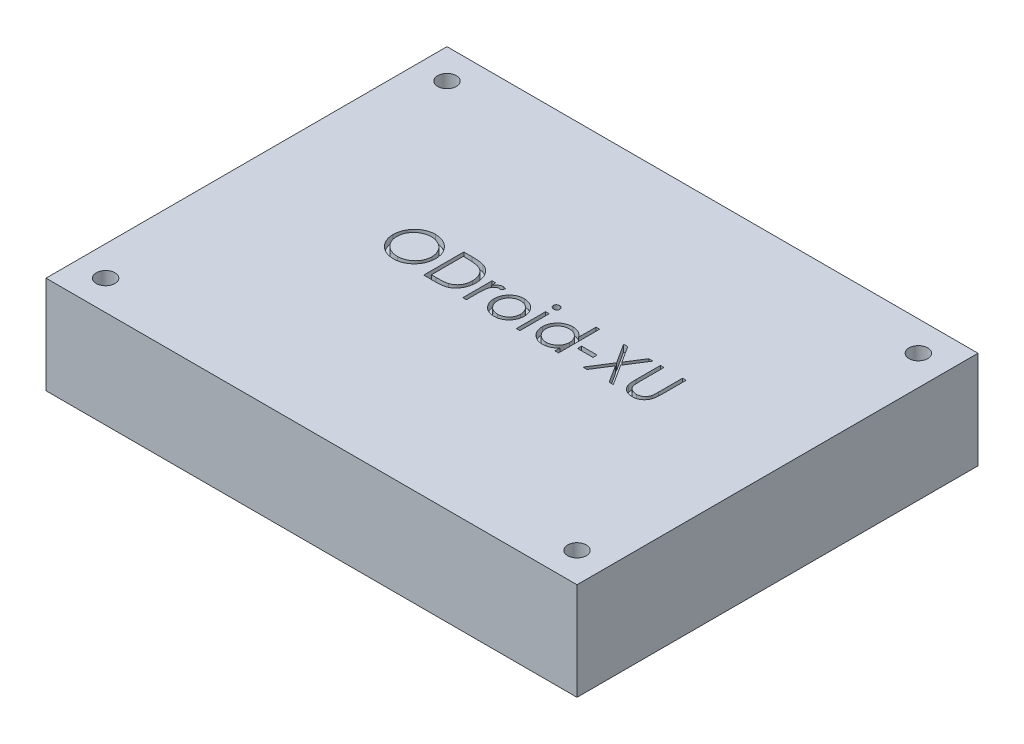
from build123d import *

# Parameters (mm, degrees)
SKETCH1_W                   = 98
SKETCH1_H                   = 74
BOSS_EXTRUDE1_DEPTH         = 18
SKETCH2_W                   = 0.664850427
SKETCH2_H                   = 5.413782051
SKETCH2_W_2                 = 2.849358974
SKETCH2_H_2                 = 0.759829059
CUT_EXTRUDE1_DEPTH          = 1.27
F_29_0_136_DIAMETER_HOLE1_D = 3.4544


with BuildPart() as part:
    # Sketch1 → Boss-Extrude1 (new body)
    with BuildSketch(Plane(origin=(0, 0, 0), x_dir=(1, 0, 0), z_dir=(0, 1, 0))):
        Rectangle(SKETCH1_W, SKETCH1_H)
    extrude(amount=BOSS_EXTRUDE1_DEPTH)

    # Sketch2 → Cut-Extrude1 (cut)
    # profile 1 of 10: a face of its own
    with BuildSketch(Plane(origin=(0, 18, 0), x_dir=(1, 0, 0), z_dir=(0, 1, 0))):
        with BuildLine():
            add(Edge.make_bspline(
                [(-20.098489134, 5.934773043), (-19.961311977, 5.931298579), (-19.691884721, 5.924474444), (-19.295909521, 5.872237008), (-18.917883236, 5.781865099), (-18.554726442, 5.661505119), (-18.210782975, 5.50094667), (-17.883463986, 5.306879773), (-17.57354827, 5.077271269), (-17.285213012, 4.813896072), (-17.021355801, 4.527334428), (-16.788891008, 4.221522851), (-16.594068153, 3.898310386), (-16.434078237, 3.558668295), (-16.308562847, 3.203364696), (-16.221950871, 2.83050539), (-16.16662512, 2.44250623), (-16.160157058, 2.177866033), (-16.156875886, 2.043617194)],
                knots=[0, 0, 0, 0, 1.065120563, 2.091984664, 3.0946048, 4.079830382, 5.057816894, 6.036188127, 7.030412546, 8.04752943, 9.064399622, 10.05169764, 11.02544977, 11.989514704, 12.962713494, 13.945757189, 14.957906945, 16, 16, 16, 16], degree=3))
            add(Edge.make_bspline(
                [(-16.156875886, 2.043617194), (-16.160156577, 1.910357266), (-16.166623198, 1.647686509), (-16.222013777, 1.262149553), (-16.308883893, 0.891540912), (-16.432912657, 0.53647928), (-16.59213992, 0.196590103), (-16.788260032, -0.127232282), (-17.019275595, -0.435094037), (-17.282180096, -0.723622512), (-17.568778968, -0.988200492), (-17.876183033, -1.218745445), (-18.197478893, -1.417128176), (-18.536801109, -1.575420285), (-18.88964952, -1.701937517), (-19.259182104, -1.788197251), (-19.64366731, -1.843838159), (-19.905860935, -1.850227351), (-20.039127489, -1.85347482)],
                knots=[0, 0, 0, 0, 1.043624062, 2.057103931, 3.04512605, 4.022047818, 4.998200453, 5.980619268, 6.982898556, 8.009068085, 9.034988726, 10.034168286, 11.015286542, 11.987931943, 12.962482838, 13.94673481, 14.956375938, 16, 16, 16, 16], degree=3))
            add(Edge.make_bspline(
                [(-20.039127489, -1.85347482), (-20.173375631, -1.850195284), (-20.438014454, -1.843730447), (-20.826501179, -1.78831314), (-21.199622404, -1.701654047), (-21.556311114, -1.577809074), (-21.896766215, -1.417752602), (-22.221653556, -1.222586666), (-22.529669085, -0.991008217), (-22.818259115, -0.728188968), (-23.082311584, -0.442075849), (-23.31251893, -0.135510009), (-23.507728753, 0.18549404), (-23.667247807, 0.521827133), (-23.793537579, 0.871863354), (-23.879696111, 1.237937631), (-23.935440542, 1.617962918), (-23.941864301, 1.876710386), (-23.945123749, 2.008000207)],
                knots=[0, 0, 0, 0, 1.053102029, 2.075944431, 3.073151272, 4.055350789, 5.033113405, 6.020478099, 7.024410459, 8.052272461, 9.079885166, 10.07527673, 11.055994387, 12.023226415, 12.992069828, 13.970394897, 14.97016774, 16, 16, 16, 16], degree=3))
            add(Edge.make_bspline(
                [(-23.945123749, 2.008000207), (-23.943992104, 2.09612269), (-23.94174309, 2.271255951), (-23.914667341, 2.531323588), (-23.875378407, 2.787208814), (-23.819071025, 3.038183987), (-23.745428664, 3.283634738), (-23.658535206, 3.525253853), (-23.552405866, 3.760592735), (-23.432431828, 3.990766247), (-23.298527668, 4.212186315), (-23.150623998, 4.421481432), (-22.993915801, 4.620407875), (-22.822119951, 4.8038107), (-22.640898476, 4.977025273), (-22.447311575, 5.137389691), (-22.242540492, 5.286350003), (-22.025704121, 5.420589725), (-21.802145439, 5.541999894), (-21.571689593, 5.646186145), (-21.337466517, 5.735606975), (-21.098379178, 5.808083388), (-20.855062478, 5.865301198), (-20.606985367, 5.90426343), (-20.354345481, 5.931408236), (-20.184141523, 5.933646615), (-20.098489134, 5.934773043)],
                knots=[0, 0, 0, 0, 1.037015668, 2.060948919, 3.074880161, 4.083647147, 5.086022904, 6.090072063, 7.104153813, 8.122640571, 9.144368836, 10.147691507, 11.138137339, 12.123020368, 13.103399296, 14.087645067, 15.080126199, 16.082011238, 17.087798457, 18.072939717, 19.057185487, 20.037253025, 21.01195951, 21.997135196, 22.992090687, 24, 24, 24, 24], degree=3))
        make_face()
        with BuildLine():
            add(Edge.make_bspline(
                [(-20.065840229, 5.174943984), (-20.136144537, 5.174086966), (-20.276081038, 5.172381124), (-20.48411664, 5.149911192), (-20.689416233, 5.117886261), (-20.892022216, 5.072205375), (-21.091086862, 5.009966797), (-21.288465693, 4.938336874), (-21.482358823, 4.851085566), (-21.672126156, 4.752506675), (-21.856096398, 4.643394793), (-22.02968995, 4.522804553), (-22.193356213, 4.393563946), (-22.346694461, 4.255371357), (-22.489254442, 4.107523033), (-22.62384206, 3.952260377), (-22.745062674, 3.785145541), (-22.856157145, 3.610710179), (-22.955572407, 3.429181499), (-23.043975741, 3.242470624), (-23.11628956, 3.04905452), (-23.175264923, 2.851031554), (-23.224159523, 2.648715347), (-23.255134662, 2.440571134), (-23.277851489, 2.227644813), (-23.279459829, 2.083749889), (-23.280273322, 2.010968289)],
                knots=[0, 0, 0, 0, 1.008559885, 2.007477868, 2.99961109, 3.989939068, 4.984837346, 5.991145699, 7.001802488, 8.033829008, 9.059044045, 10.069351652, 11.065060232, 12.050310815, 13.029377138, 14.011219647, 14.996725999, 15.989392538, 16.977580475, 17.965360261, 18.951710183, 19.937753436, 20.929683414, 21.935841486, 22.955955122, 24, 24, 24, 24], degree=3))
            add(Edge.make_bspline(
                [(-23.280273322, 2.010968289), (-23.277574864, 1.903944922), (-23.272266163, 1.693396849), (-23.225789306, 1.384854278), (-23.15419946, 1.088334072), (-23.048668035, 0.805458697), (-22.916692567, 0.533796632), (-22.753652316, 0.275757811), (-22.560487251, 0.031272493), (-22.34106612, -0.197952493), (-22.101199725, -0.407176112), (-21.846495446, -0.590825327), (-21.579681977, -0.746210356), (-21.300063531, -0.872797759), (-21.009132907, -0.973106037), (-20.705015424, -1.041852473), (-20.389736951, -1.087097187), (-20.174830398, -1.091442187), (-20.065840229, -1.09364576)],
                knots=[0, 0, 0, 0, 1.032063989, 2.030389145, 3.003944642, 3.970395727, 4.937377036, 5.913328081, 6.909231446, 7.93887556, 8.970685674, 9.976071282, 10.964166581, 11.944589148, 12.933237628, 13.927779006, 14.949070134, 16, 16, 16, 16], degree=3))
            add(Edge.make_bspline(
                [(-20.065840229, -1.09364576), (-19.992583451, -1.092639276), (-19.847293257, -1.090643115), (-19.631191068, -1.070537583), (-19.418982087, -1.038296792), (-19.210963961, -0.991876905), (-19.007372777, -0.933780318), (-18.807358777, -0.864760627), (-18.613052396, -0.778652079), (-18.422002406, -0.683512248), (-18.239130361, -0.575053915), (-18.064557151, -0.458556498), (-17.902682993, -0.329506251), (-17.749459459, -0.193366881), (-17.606314184, -0.047393403), (-17.474215167, 0.1082244), (-17.353607221, 0.274468791), (-17.242554935, 0.448639567), (-17.143488029, 0.630664968), (-17.05717227, 0.818052787), (-16.983943824, 1.010341601), (-16.924828489, 1.207808761), (-16.878504262, 1.410079224), (-16.846585098, 1.617423823), (-16.82425757, 1.829427765), (-16.822574656, 1.972818926), (-16.821726314, 2.045101235)],
                knots=[0, 0, 0, 0, 1.047197238, 2.076906641, 3.100256066, 4.114471768, 5.12198147, 6.126382909, 7.136867548, 8.15857795, 9.17633901, 10.174870724, 11.156907918, 12.133735059, 13.104061851, 14.077631395, 15.04955518, 16.038496417, 17.029181396, 18.010275684, 18.986308667, 19.968651475, 20.955262928, 21.950658345, 22.966943676, 24, 24, 24, 24], degree=3))
            add(Edge.make_bspline(
                [(-16.821726314, 2.045101235), (-16.822575336, 2.116889053), (-16.824259528, 2.259293412), (-16.846574433, 2.469818811), (-16.878537984, 2.675671442), (-16.924602383, 2.876043158), (-16.983975208, 3.070985036), (-17.057185058, 3.260313986), (-17.143513942, 3.444735332), (-17.24259135, 3.623793261), (-17.35396151, 3.795613123), (-17.475657658, 3.959871563), (-17.609780978, 4.113483865), (-17.752499398, 4.260242301), (-17.907377771, 4.397016834), (-18.073714527, 4.523852836), (-18.249490312, 4.643811266), (-18.43560296, 4.752027039), (-18.627677662, 4.851963831), (-18.824768873, 4.937585121), (-19.024643801, 5.010339441), (-19.226794172, 5.072393684), (-19.432921476, 5.117707347), (-19.641632914, 5.149940053), (-19.852639728, 5.172373303), (-19.994547876, 5.174084371), (-20.065840229, 5.174943984)],
                knots=[0, 0, 0, 0, 1.02996197, 2.043119294, 3.035359645, 4.018872909, 4.991431989, 5.957985074, 6.929999688, 7.912076566, 8.892894881, 9.867085534, 10.843653904, 11.817741046, 12.803660682, 13.806313499, 14.818574707, 15.856120519, 16.894564902, 17.924820532, 18.937903209, 19.946497019, 20.957711757, 21.963978472, 22.977135795, 24, 24, 24, 24], degree=3))
        make_face(mode=Mode.SUBTRACT)
    # profile 2 of 10: a face of its own
    with BuildSketch(Plane(origin=(0, 18, 0), x_dir=(1, 0, 0), z_dir=(0, 1, 0))):
        with BuildLine():
            Line((-14.637217767, -1.663517555), (-14.637217767, 5.744815779))
            Line((-14.637217767, 5.744815779), (-13.141304305, 5.744815779))
            add(Edge.make_bspline(
                [(-13.141304305, 5.744815779), (-13.011194947, 5.743879005), (-12.759824343, 5.742069165), (-12.396577996, 5.730593887), (-12.060485699, 5.710294067), (-11.752652814, 5.680725237), (-11.472234249, 5.644417982), (-11.220015195, 5.598908793), (-10.994691492, 5.545170499), (-10.85611451, 5.499354296), (-10.790583151, 5.477688375)],
                knots=[0, 0, 0, 0, 1.314313732, 2.53924729, 3.670748893, 4.714932338, 5.66265055, 6.526160246, 7.303039223, 8, 8, 8, 8], degree=3))
            add(Edge.make_bspline(
                [(-10.790583151, 5.477688375), (-10.704869286, 5.445026714), (-10.535385263, 5.380444052), (-10.294070187, 5.258616547), (-10.066898168, 5.120582149), (-9.852650978, 4.966158906), (-9.656222562, 4.790974368), (-9.469939181, 4.602470204), (-9.301421349, 4.39379155), (-9.147098789, 4.169266159), (-9.00795831, 3.931538982), (-8.887013759, 3.681063002), (-8.786569473, 3.419110245), (-8.703187143, 3.146409182), (-8.637472142, 2.862360182), (-8.592637053, 2.566632499), (-8.563065124, 2.260394881), (-8.560093216, 2.052592266), (-8.558585288, 1.947154521)],
                knots=[0, 0, 0, 0, 0.984719456, 1.947108742, 2.898477687, 3.838006223, 4.779231079, 5.722358779, 6.681677486, 7.655904652, 8.64651281, 9.637519902, 10.640069247, 11.656948941, 12.698408672, 13.768548281, 14.867775369, 16, 16, 16, 16], degree=3))
            add(Edge.make_bspline(
                [(-8.558585288, 1.947154521), (-8.559916602, 1.855584899), (-8.562540097, 1.675137396), (-8.586097149, 1.4091975), (-8.620337026, 1.151147107), (-8.673347245, 0.902215042), (-8.737699232, 0.660220314), (-8.820173352, 0.427742064), (-8.914651819, 0.202647668), (-9.024824062, -0.012019323), (-9.145773327, -0.215395795), (-9.275571016, -0.407113996), (-9.414078688, -0.584438215), (-9.562617111, -0.747905444), (-9.719266778, -0.897269252), (-9.885053277, -1.033777351), (-10.060404402, -1.154758725), (-10.244534765, -1.264967438), (-10.442815905, -1.36110719), (-10.659003488, -1.442450711), (-10.894019482, -1.50985938), (-11.147287024, -1.56610111), (-11.419243718, -1.610714734), (-11.710156196, -1.640615598), (-12.019577493, -1.660835972), (-12.232046937, -1.662606338), (-12.341406135, -1.663517555)],
                knots=[0, 0, 0, 0, 1.105936401, 2.179363191, 3.223086493, 4.248585256, 5.251745608, 6.245858792, 7.225916811, 8.198733463, 9.158002045, 10.082870192, 10.993790845, 11.873723703, 12.748670949, 13.606408763, 14.465103618, 15.319838547, 16.196477973, 17.123216899, 18.106603292, 19.147568657, 20.255746949, 21.433717677, 22.679120308, 24, 24, 24, 24], degree=3))
            Line((-12.341406135, -1.663517555), (-14.637217767, -1.663517555))
        make_face()
        with BuildLine():
            Line((-13.972367339, -0.903688495), (-13.12201177, -0.903688495))
            add(Edge.make_bspline(
                [(-13.12201177, -0.903688495), (-12.999820052, -0.903163358), (-12.764800629, -0.902153326), (-12.426857868, -0.893290413), (-12.118079812, -0.878808312), (-11.838422617, -0.858541064), (-11.588044182, -0.831725828), (-11.366421245, -0.801828118), (-11.174280282, -0.76458018), (-11.058012974, -0.730817316), (-11.004285074, -0.715215271)],
                knots=[0, 0, 0, 0, 1.375205317, 2.645023457, 3.804390687, 4.853969522, 5.800190428, 6.637939096, 7.370582563, 8, 8, 8, 8], degree=3))
            add(Edge.make_bspline(
                [(-11.004285074, -0.715215271), (-10.936661041, -0.691399473), (-10.803028174, -0.644336716), (-10.61066321, -0.558489667), (-10.431260883, -0.456800619), (-10.261694663, -0.343765806), (-10.104369909, -0.215398435), (-9.957422196, -0.074489842), (-9.821147384, 0.079677099), (-9.696953432, 0.246911041), (-9.585810855, 0.426171108), (-9.489563419, 0.615694973), (-9.405211011, 0.813406054), (-9.339004656, 1.02234044), (-9.287113336, 1.240630281), (-9.25035808, 1.468290932), (-9.227466913, 1.705279879), (-9.224796849, 1.866468542), (-9.223435715, 1.948638562)],
                knots=[0, 0, 0, 0, 0.998632004, 1.973411704, 2.929992603, 3.868527914, 4.809262121, 5.754881198, 6.702106254, 7.672490631, 8.653608572, 9.636854334, 10.631411391, 11.644891563, 12.686317036, 13.754757253, 14.855430412, 16, 16, 16, 16], degree=3))
            add(Edge.make_bspline(
                [(-9.223435715, 1.948638562), (-9.224522174, 2.035281095), (-9.22665653, 2.205491119), (-9.253483821, 2.45523809), (-9.29268778, 2.6954388), (-9.349379915, 2.926109314), (-9.421623609, 3.147699659), (-9.511782267, 3.358984289), (-9.614793278, 3.562194595), (-9.737355341, 3.752640336), (-9.871585014, 3.932754084), (-10.020551525, 4.097758655), (-10.181888173, 4.248029924), (-10.353835271, 4.385908136), (-10.541238798, 4.50584625), (-10.73968411, 4.613133058), (-10.952082447, 4.704183361), (-11.099852654, 4.752610287), (-11.174949804, 4.77722096)],
                knots=[0, 0, 0, 0, 1.122418816, 2.205001699, 3.251619955, 4.274784885, 5.280384055, 6.268708349, 7.249350384, 8.229342522, 9.199999885, 10.157847722, 11.105861043, 12.055065948, 13.010012805, 13.98527497, 14.976112212, 16, 16, 16, 16], degree=3))
            add(Edge.make_bspline(
                [(-11.174949804, 4.77722096), (-11.237076398, 4.794400732), (-11.36917458, 4.830929642), (-11.584734779, 4.870776681), (-11.827336846, 4.90592287), (-12.09805788, 4.935679053), (-12.396589285, 4.95703055), (-12.723160658, 4.9730565), (-13.077913154, 4.983865538), (-13.323832851, 4.984603635), (-13.451468902, 4.984986719)],
                knots=[0, 0, 0, 0, 0.674548936, 1.434276114, 2.292660221, 3.240891867, 4.284742987, 5.42552168, 6.663806718, 8, 8, 8, 8], degree=3))
            Line((-13.451468902, 4.984986719), (-13.972367339, 4.984986719))
            Line((-13.972367339, 4.984986719), (-13.972367339, -0.903688495))
        make_face(mode=Mode.SUBTRACT)
    # profile 3 of 10: a face of its own
    with BuildSketch(Plane(origin=(0, 18, 0), x_dir=(1, 0, 0), z_dir=(0, 1, 0))):
        with BuildLine():
            Line((-7.418841698, 3.750264496), (-6.753991271, 3.750264496))
            Line((-6.753991271, 3.750264496), (-6.753991271, 2.953334408))
            add(Edge.make_bspline(
                [(-6.753991271, 2.953334408), (-6.704908398, 3.027535912), (-6.611037785, 3.16944571), (-6.455012085, 3.357129064), (-6.2951967, 3.512524246), (-6.130826554, 3.636356694), (-5.960692909, 3.729094462), (-5.788529695, 3.79702472), (-5.611628284, 3.83719337), (-5.492752211, 3.842556282), (-5.433194663, 3.845243129)],
                knots=[0, 0, 0, 0, 1.2804753, 2.448899062, 3.506932113, 4.484331642, 5.4025378, 6.288909075, 7.142734305, 8, 8, 8, 8], degree=3))
            add(Edge.make_bspline(
                [(-5.433194663, 3.845243129), (-5.386995605, 3.842723181), (-5.291938041, 3.837538224), (-5.14804156, 3.801108645), (-4.99978292, 3.742946831), (-4.904231534, 3.688251693), (-4.854418621, 3.659737987)],
                knots=[0, 0, 0, 0, 0.901110191, 1.854092781, 2.881294221, 4, 4, 4, 4], degree=3))
            Line((-4.854418621, 3.659737987), (-5.21949274, 3.083930028))
            add(Edge.make_bspline(
                [(-5.21949274, 3.083930028), (-5.251473501, 3.098196925), (-5.312179109, 3.125278226), (-5.400982941, 3.157328814), (-5.482858437, 3.176200836), (-5.535020635, 3.179059854), (-5.559338159, 3.180392702)],
                knots=[0, 0, 0, 0, 1.180555205, 2.24091978, 3.179933427, 4, 4, 4, 4], degree=3))
            add(Edge.make_bspline(
                [(-5.559338159, 3.180392702), (-5.612690295, 3.176836623), (-5.721513187, 3.169583252), (-5.881288711, 3.112562776), (-6.036328629, 3.020434351), (-6.159458648, 2.918260497), (-6.254798083, 2.819734326), (-6.322828227, 2.733695207), (-6.385233375, 2.637220437), (-6.444860341, 2.531959273), (-6.499187331, 2.416114432), (-6.549891381, 2.290843297), (-6.595735974, 2.156000775), (-6.621877324, 2.062057773), (-6.63526798, 2.013936371)],
                knots=[0, 0, 0, 0, 1.125678352, 2.296057538, 3.5422874, 4.923748041, 5.663163013, 6.437101912, 7.23742474, 8.08941207, 8.991984279, 9.93940061, 10.944477711, 12, 12, 12, 12], degree=3))
            add(Edge.make_bspline(
                [(-6.63526798, 2.013936371), (-6.645284879, 1.971016354), (-6.66747155, 1.875951777), (-6.689043639, 1.716464066), (-6.710357452, 1.528030655), (-6.725378627, 1.310127034), (-6.73930215, 1.063297361), (-6.747155157, 0.787165609), (-6.753723471, 0.481448349), (-6.753899296, 0.267719302), (-6.753991271, 0.155916874)],
                knots=[0, 0, 0, 0, 0.566838948, 1.255505196, 2.06880316, 3.007127437, 4.065329342, 5.249902469, 6.561414163, 8, 8, 8, 8], degree=3))
            Line((-6.753991271, 0.155916874), (-6.753991271, -1.663517555))
            Line((-6.753991271, -1.663517555), (-7.418841698, -1.663517555))
            Line((-7.418841698, -1.663517555), (-7.418841698, 3.750264496))
        make_face()
    # profile 4 of 10: a face of its own
    with BuildSketch(Plane(origin=(0, 18, 0), x_dir=(1, 0, 0), z_dir=(0, 1, 0))):
        with BuildLine():
            add(Edge.make_bspline(
                [(-1.574687718, 3.845243129), (-1.473106191, 3.843080126), (-1.273929641, 3.838839006), (-0.982236282, 3.793510662), (-0.703799078, 3.724195407), (-0.437551638, 3.628370601), (-0.186903812, 3.499927139), (0.051795321, 3.346660806), (0.277891323, 3.16508765), (0.413406735, 3.024629738), (0.482193291, 2.953334408)],
                knots=[0, 0, 0, 0, 1.054011418, 2.066658804, 3.057071809, 4.030435133, 4.997543892, 5.974964718, 6.972108034, 8, 8, 8, 8], degree=3))
            add(Edge.make_bspline(
                [(0.482193291, 2.953334408), (0.541421761, 2.885148138), (0.658732465, 2.750095191), (0.809154904, 2.531114143), (0.938740539, 2.304334264), (1.042590473, 2.066744089), (1.124473773, 1.820417702), (1.182609497, 1.564508445), (1.217189343, 1.299581477), (1.221852289, 1.119656686), (1.224213857, 1.02853306)],
                knots=[0, 0, 0, 0, 1.025258237, 2.030674902, 3.01204498, 3.988269485, 4.97094183, 5.956517959, 6.965070386, 8, 8, 8, 8], degree=3))
            add(Edge.make_bspline(
                [(1.224213857, 1.02853306), (1.222136693, 0.936881271), (1.21803212, 0.755773062), (1.179204799, 0.489032071), (1.118814001, 0.230386363), (1.03238661, -0.019081205), (0.921561945, -0.26013319), (0.786326657, -0.491716736), (0.625731734, -0.714288752), (0.443689941, -0.925959309), (0.242496803, -1.121044464), (0.024234289, -1.291072634), (-0.206808416, -1.436744861), (-0.453703514, -1.554085274), (-0.714196361, -1.64660414), (-0.988848822, -1.711585841), (-1.277234221, -1.750874738), (-1.474141839, -1.755919969), (-1.574687718, -1.758496187)],
                knots=[0, 0, 0, 0, 0.998656419, 1.973391657, 2.932242238, 3.890759089, 4.846373663, 5.82037756, 6.809684879, 7.83454468, 8.860553229, 9.859544525, 10.845671541, 11.83227036, 12.833544569, 13.85385346, 14.904124723, 16, 16, 16, 16], degree=3))
            add(Edge.make_bspline(
                [(-1.574687718, -1.758496187), (-1.675726208, -1.755911322), (-1.873615194, -1.750848733), (-2.163018523, -1.711738484), (-2.438163216, -1.646634088), (-2.698997083, -1.553781228), (-2.946953676, -1.436741111), (-3.179335094, -1.291513034), (-3.397774916, -1.120994039), (-3.599010616, -0.925972972), (-3.781040997, -0.714285231), (-3.941638865, -0.49171765), (-4.076873389, -0.260132952), (-4.187698253, -0.019081269), (-4.274125591, 0.23038638), (-4.334516404, 0.489032066), (-4.373343721, 0.755773063), (-4.377448295, 0.936881271), (-4.379525459, 1.02853306)],
                knots=[0, 0, 0, 0, 1.099876186, 2.154163076, 3.173186993, 4.173200201, 5.163417411, 6.152872554, 7.150605724, 8.17532212, 9.198891216, 10.186952605, 11.159729845, 12.11414092, 13.071450619, 14.029093627, 15.002601286, 16, 16, 16, 16], degree=3))
            add(Edge.make_bspline(
                [(-4.379525459, 1.02853306), (-4.377147785, 1.119161415), (-4.3724404, 1.298589983), (-4.337895323, 1.563018928), (-4.279986378, 1.818495069), (-4.198004922, 2.063870659), (-4.093197768, 2.300419666), (-3.965433042, 2.527759891), (-3.813476203, 2.745750736), (-3.696632072, 2.880629138), (-3.637504893, 2.948882285)],
                knots=[0, 0, 0, 0, 1.031353054, 2.041901799, 3.029428768, 4.008703097, 4.981709435, 5.96992636, 6.972712378, 8, 8, 8, 8], degree=3))
            add(Edge.make_bspline(
                [(-3.637504893, 2.948882285), (-3.568822042, 3.020795906), (-3.43374513, 3.162226697), (-3.206523656, 3.343270539), (-2.968411735, 3.499726229), (-2.714993974, 3.625617552), (-2.448965258, 3.724759081), (-2.169101195, 3.793689421), (-1.876418021, 3.838675689), (-1.676266823, 3.843032166), (-1.574687718, 3.845243129)],
                knots=[0, 0, 0, 0, 1.027980169, 2.021703884, 2.998553061, 3.971491411, 4.943284454, 5.930300938, 6.949603206, 8, 8, 8, 8], degree=3))
        make_face()
        with BuildLine():
            add(Edge.make_bspline(
                [(-1.577655801, 3.180392702), (-1.649490411, 3.178350983), (-1.791305234, 3.174320251), (-2.000050021, 3.143662653), (-2.20100668, 3.095090436), (-2.394556467, 3.026078517), (-2.580046682, 2.936969181), (-2.757654917, 2.827519818), (-2.927903582, 2.69918006), (-3.087462283, 2.552150739), (-3.233898177, 2.3915402), (-3.361909894, 2.220411174), (-3.470759702, 2.041539408), (-3.561438039, 1.854738894), (-3.62897492, 1.658116618), (-3.678024484, 1.453899282), (-3.70865316, 1.241670817), (-3.712645995, 1.097396662), (-3.714675031, 1.024080936)],
                knots=[0, 0, 0, 0, 1.021534396, 2.016698045, 2.994645724, 3.958388632, 4.93408049, 5.916473867, 6.921342795, 7.962252576, 8.998418191, 10.008913653, 10.997312074, 11.973003931, 12.956656626, 13.948281152, 14.957379055, 16, 16, 16, 16], degree=3))
            add(Edge.make_bspline(
                [(-3.714675031, 1.024080936), (-3.711273921, 0.929355812), (-3.704523354, 0.741344154), (-3.649627104, 0.464460611), (-3.557792811, 0.19864569), (-3.433783069, -0.054542327), (-3.278406573, -0.288798649), (-3.095342282, -0.49765329), (-2.886554916, -0.677963258), (-2.654533324, -0.827571048), (-2.404016684, -0.946442531), (-2.138890805, -1.030683696), (-1.862368002, -1.085445445), (-1.673390455, -1.090888399), (-1.577655801, -1.09364576)],
                knots=[0, 0, 0, 0, 1.016792936, 2.018143844, 3.017858371, 4.030088057, 5.03801393, 6.028138512, 7.003788237, 7.991172063, 8.984598303, 9.972568034, 10.972917682, 12, 12, 12, 12], degree=3))
            add(Edge.make_bspline(
                [(-1.577655801, -1.09364576), (-1.481926653, -1.090872333), (-1.292959975, -1.085397666), (-1.016821384, -1.030959498), (-0.752420144, -0.946073416), (-0.502163707, -0.827704739), (-0.270247729, -0.677395127), (-0.059958756, -0.498671462), (0.121542471, -0.288245477), (0.276765268, -0.054232041), (0.402805873, 0.198253171), (0.494210317, 0.464509671), (0.549238541, 0.741331659), (0.555971295, 0.929351626), (0.55936343, 1.024080936)],
                knots=[0, 0, 0, 0, 1.02726834, 2.027799167, 3.010890988, 4.004497153, 4.992059811, 5.971914811, 6.958719428, 7.966827853, 8.981595046, 9.981490638, 10.983022906, 12, 12, 12, 12], degree=3))
            add(Edge.make_bspline(
                [(0.55936343, 1.024080936), (0.557335092, 1.0973971), (0.553343632, 1.241672118), (0.522704957, 1.453894311), (0.473692398, 1.658134857), (0.406019142, 1.854671598), (0.315734812, 2.042023065), (0.204785934, 2.219885987), (0.07729693, 2.39213301), (-0.070905976, 2.551631549), (-0.230298126, 2.699237377), (-0.40061579, 2.827569584), (-0.577960661, 2.936488162), (-0.762911995, 3.026840704), (-0.956486596, 3.094462574), (-1.157161686, 3.143943111), (-1.365015834, 3.174190694), (-1.506322475, 3.178312143), (-1.577655801, 3.180392702)],
                knots=[0, 0, 0, 0, 1.042956736, 2.052379634, 3.044323526, 4.02829302, 5.004299113, 5.996692471, 7.007513377, 8.048758398, 9.090003419, 10.095195979, 11.07790575, 12.047570684, 13.018257071, 13.989683339, 14.985167495, 16, 16, 16, 16], degree=3))
        make_face(mode=Mode.SUBTRACT)
    # profile 5 of 10: a face of its own
    with BuildSketch(Plane(origin=(0, 18, 0), x_dir=(1, 0, 0), z_dir=(0, 1, 0))):
        with BuildLine():
            add(Edge.make_bspline(
                [(2.788393211, 6.029751676), (2.829649829, 6.027837887), (2.910438212, 6.02409032), (3.027263962, 5.991998527), (3.133641304, 5.937600859), (3.227997506, 5.864618868), (3.308963999, 5.778789213), (3.365649836, 5.678753496), (3.402082741, 5.570679378), (3.40648235, 5.495294106), (3.408722404, 5.456911799)],
                knots=[0, 0, 0, 0, 1.055194115, 2.066272739, 3.074728998, 4.095836921, 5.109056067, 6.073838105, 7.019297344, 8, 8, 8, 8], degree=3))
            add(Edge.make_bspline(
                [(3.408722404, 5.456911799), (3.406431833, 5.41952585), (3.401903644, 5.345618253), (3.365677977, 5.239417737), (3.308480907, 5.140772003), (3.228049424, 5.055109), (3.133627547, 4.982167354), (3.027267617, 4.92775899), (2.910437251, 4.895670033), (2.829649504, 4.891922075), (2.788393211, 4.890008086)],
                knots=[0, 0, 0, 0, 0.96129708, 1.900370562, 2.859976407, 3.87933698, 4.906634145, 5.921202961, 6.938410037, 8, 8, 8, 8], degree=3))
            add(Edge.make_bspline(
                [(2.788393211, 4.890008086), (2.747608695, 4.891848994), (2.668226964, 4.895432081), (2.553150481, 4.928388618), (2.447680178, 4.982185973), (2.353139955, 5.054631398), (2.274336046, 5.141298097), (2.216977924, 5.239357536), (2.180835921, 5.34563358), (2.176296457, 5.419530998), (2.174000182, 5.456911799)],
                knots=[0, 0, 0, 0, 1.054934014, 2.053291228, 3.073705704, 4.106921865, 5.123545215, 6.088680038, 7.033164197, 8, 8, 8, 8], degree=3))
            add(Edge.make_bspline(
                [(2.174000182, 5.456911799), (2.176246149, 5.495288764), (2.180657369, 5.570663545), (2.217005015, 5.678814698), (2.273858275, 5.778258876), (2.353192134, 5.865096183), (2.447666292, 5.937582354), (2.553154069, 5.991368931), (2.668226016, 6.024328266), (2.747608374, 6.027910967), (2.788393211, 6.029751676)],
                knots=[0, 0, 0, 0, 0.98631895, 1.937192651, 2.907499808, 3.917963147, 4.944918757, 5.95915025, 6.951458133, 8, 8, 8, 8], degree=3))
        make_face()
    # profile 6 of 10: a face of its own
    with BuildSketch(Plane(origin=(0, 18, 0), x_dir=(1, 0, 0), z_dir=(0, 1, 0))):
        with Locations((2.791361294, 1.043373471)):
            Rectangle(SKETCH2_W, SKETCH2_H)
    # profile 7 of 10: a face of its own
    with BuildSketch(Plane(origin=(0, 18, 0), x_dir=(1, 0, 0), z_dir=(0, 1, 0))):
        with BuildLine():
            Line((10.247183943, 5.934773043), (10.247183943, -1.663517555))
            Line((10.247183943, -1.663517555), (9.582333516, -1.663517555))
            Line((9.582333516, -1.663517555), (9.582333516, -0.7270876))
            add(Edge.make_bspline(
                [(9.582333516, -0.7270876), (9.507363742, -0.811838074), (9.361059286, -0.97722969), (9.11670892, -1.193303621), (8.857696277, -1.371904402), (8.58527848, -1.516155057), (8.299701532, -1.624511576), (8.001598481, -1.701528946), (7.690847724, -1.751045897), (7.478646907, -1.755990477), (7.371112228, -1.758496187)],
                knots=[0, 0, 0, 0, 1.074387032, 2.096679803, 3.090159297, 4.057316773, 5.018401886, 5.985159533, 6.978961417, 8, 8, 8, 8], degree=3))
            add(Edge.make_bspline(
                [(7.371112228, -1.758496187), (7.275506726, -1.755900366), (7.086968442, -1.750781291), (6.809623562, -1.711067749), (6.542728301, -1.647291266), (6.286030455, -1.55860105), (6.041191081, -1.440954978), (5.806113876, -1.300109336), (5.582016678, -1.132382912), (5.372315254, -0.940638252), (5.17920752, -0.732368863), (5.009744493, -0.510234122), (4.868450474, -0.275194579), (4.75029797, -0.03022607), (4.659289041, 0.226557177), (4.595844848, 0.494267182), (4.556177569, 0.772587415), (4.551060611, 0.962112738), (4.548465994, 1.058213882)],
                knots=[0, 0, 0, 0, 1.033919861, 2.038935746, 3.024066025, 3.998881131, 4.97069526, 5.957263378, 6.95902576, 7.993208707, 9.027059324, 10.027763471, 11.009749337, 11.988697705, 12.965288445, 13.950418724, 14.960734635, 16, 16, 16, 16], degree=3))
            add(Edge.make_bspline(
                [(4.548465994, 1.058213882), (4.551118117, 1.152328721), (4.556361221, 1.338388681), (4.595420536, 1.612028592), (4.661102838, 1.875592244), (4.753279115, 2.128231107), (4.87147792, 2.37025088), (5.015259037, 2.601822733), (5.184632851, 2.823584624), (5.379900446, 3.030322054), (5.591429043, 3.221289021), (5.81771919, 3.387254834), (6.053141802, 3.530588831), (6.301348508, 3.644155356), (6.558665546, 3.73603796), (6.827383673, 3.799607743), (7.106384848, 3.837067073), (7.29580639, 3.84249159), (7.391888804, 3.845243129)],
                knots=[0, 0, 0, 0, 1.020392517, 2.01726096, 2.990465484, 3.961182959, 4.928053699, 5.906110375, 6.912531644, 7.948652711, 8.985773172, 9.998621852, 10.987621588, 11.969261332, 12.953316658, 13.946091881, 14.958173133, 16, 16, 16, 16], degree=3))
            add(Edge.make_bspline(
                [(7.391888804, 3.845243129), (7.50241438, 3.841926109), (7.719363804, 3.835415168), (8.036649008, 3.781003357), (8.336766117, 3.689641933), (8.62144294, 3.564565387), (8.888982326, 3.402003797), (9.141345382, 3.205679899), (9.374143415, 2.97003744), (9.511878773, 2.793059609), (9.582333516, 2.702531457)],
                knots=[0, 0, 0, 0, 1.031072012, 2.023879775, 2.993683497, 3.952812103, 4.918022106, 5.908088563, 6.929940113, 8, 8, 8, 8], degree=3))
            Line((9.582333516, 2.702531457), (9.582333516, 5.934773043))
            Line((9.582333516, 5.934773043), (10.247183943, 5.934773043))
        make_face()
        with BuildLine():
            add(Edge.make_bspline(
                [(7.400793051, 3.180392702), (7.303607702, 3.176934835), (7.111779282, 3.170109557), (6.830169478, 3.116825658), (6.560689418, 3.028169934), (6.304686894, 2.906923243), (6.066205836, 2.754462417), (5.853070899, 2.570055489), (5.663538848, 2.358733809), (5.504136355, 2.121451009), (5.374193137, 1.867074049), (5.282822919, 1.601168989), (5.222563012, 1.328531786), (5.216406644, 1.143614101), (5.213316422, 1.050793677)],
                knots=[0, 0, 0, 0, 1.031046209, 2.035121221, 3.029706178, 4.034933723, 5.034054252, 6.02443088, 7.017295772, 8.038157696, 9.050218397, 10.03989886, 11.016116709, 12, 12, 12, 12], degree=3))
            add(Edge.make_bspline(
                [(5.213316422, 1.050793677), (5.217263779, 0.95852795), (5.225143022, 0.774358146), (5.281765325, 0.501349259), (5.376761057, 0.235381537), (5.50639009, -0.021287566), (5.668710112, -0.259590579), (5.85685776, -0.474940505), (6.072652522, -0.6601268), (6.311682412, -0.815146331), (6.566969283, -0.940373667), (6.835434438, -1.027507604), (7.112031205, -1.083763906), (7.300101978, -1.090335049), (7.394856886, -1.09364576)],
                knots=[0, 0, 0, 0, 0.979072187, 1.954306742, 2.945804271, 3.96968567, 4.997920485, 5.998718438, 6.996577872, 8.005894225, 9.015743152, 10.005417472, 10.995077863, 12, 12, 12, 12], degree=3))
            add(Edge.make_bspline(
                [(7.394856886, -1.09364576), (7.491051984, -1.09013217), (7.682374492, -1.083143987), (7.964819757, -1.029631975), (8.238917428, -0.941221352), (8.500933728, -0.818668201), (8.745019539, -0.666781797), (8.964090047, -0.488966788), (9.14933218, -0.282161715), (9.306373203, -0.054881556), (9.429511169, 0.194275503), (9.519207161, 0.459566207), (9.572237928, 0.74099979), (9.578921789, 0.933328436), (9.582333516, 1.031501142)],
                knots=[0, 0, 0, 0, 1.01762866, 2.023962475, 3.030623092, 4.058876274, 5.077231937, 6.066672613, 7.034107872, 8.005628644, 8.981990164, 9.965428785, 10.961468474, 12, 12, 12, 12], degree=3))
            add(Edge.make_bspline(
                [(9.582333516, 1.031501142), (9.580302243, 1.10629955), (9.576304055, 1.253526487), (9.54575935, 1.469696399), (9.497171422, 1.676566119), (9.428705363, 1.874353144), (9.338765477, 2.061963927), (9.230291039, 2.240745553), (9.101374504, 2.409768184), (8.954091131, 2.56670435), (8.792874785, 2.709847029), (8.622283008, 2.837618005), (8.44029466, 2.942580907), (8.249970265, 3.029451599), (8.050979607, 3.098580133), (7.841703462, 3.144697418), (7.624366273, 3.176363431), (7.476102122, 3.17903547), (7.400793051, 3.180392702)],
                knots=[0, 0, 0, 0, 1.050140795, 2.067009409, 3.05949893, 4.030605086, 5.00011959, 5.97591094, 6.962425594, 7.979863591, 8.993523472, 9.986985069, 10.967611495, 11.937549037, 12.921786183, 13.919465291, 14.943216303, 16, 16, 16, 16], degree=3))
        make_face(mode=Mode.SUBTRACT)
    # profile 8 of 10: a face of its own
    with BuildSketch(Plane(origin=(0, 18, 0), x_dir=(1, 0, 0), z_dir=(0, 1, 0))):
        with Locations((12.716628387, 1.185841419)):
            Rectangle(SKETCH2_W_2, SKETCH2_H_2)
    # profile 9 of 10: a face of its own
    with BuildSketch(Plane(origin=(0, 18, 0), x_dir=(1, 0, 0), z_dir=(0, 1, 0))):
        Polygon((14.853647618, 5.744815779), (15.620896884, 5.744815779), (17.560538644, 2.714403786), (19.500180404, 5.744815779), (20.267429669, 5.744815779), (17.944905297, 2.114851168), (20.362408302, -1.663517555), (19.595159036, -1.663517555), (17.560538644, 1.515298551), (15.525918251, -1.663517555), (14.758668986, -1.663517555), (17.177656032, 2.114851168), align=None)
    # profile 10 of 10: a face of its own
    with BuildSketch(Plane(origin=(0, 18, 0), x_dir=(1, 0, 0), z_dir=(0, 1, 0))):
        with BuildLine():
            Line((21.64461984, 5.744815779), (22.309470268, 5.744815779))
            Line((22.309470268, 5.744815779), (22.309470268, 1.306048751))
            add(Edge.make_bspline(
                [(22.309470268, 1.306048751), (22.309371326, 1.243224527), (22.309183568, 1.124004736), (22.310437722, 0.954315166), (22.313950052, 0.803455128), (22.316164423, 0.670843109), (22.321090612, 0.557087627), (22.325108145, 0.461572386), (22.33027399, 0.384749657), (22.336482422, 0.339916697), (22.33915109, 0.320645439)],
                knots=[0, 0, 0, 0, 1.528628734, 2.90083645, 4.128790002, 5.200304208, 6.127813768, 6.898992206, 7.526736466, 8, 8, 8, 8], degree=3))
            add(Edge.make_bspline(
                [(22.33915109, 0.320645439), (22.350110045, 0.25111979), (22.371410456, 0.115986014), (22.425695289, -0.076436516), (22.501508999, -0.249858103), (22.591346773, -0.409690336), (22.709737467, -0.551484481), (22.851561617, -0.68210748), (23.023387893, -0.7963478), (23.214439509, -0.900807018), (23.420359928, -0.984764776), (23.630780442, -1.04825073), (23.842538081, -1.086941068), (23.984304297, -1.091421075), (24.054702639, -1.09364576)],
                knots=[0, 0, 0, 0, 1.035780045, 2.013197591, 2.933192213, 3.817615948, 4.702609284, 5.640816605, 6.646850145, 7.73207398, 8.84249596, 9.914020372, 10.964143139, 12, 12, 12, 12], degree=3))
            add(Edge.make_bspline(
                [(24.054702639, -1.09364576), (24.11514139, -1.091372777), (24.235669813, -1.086839939), (24.414753424, -1.05876991), (24.589166988, -1.008180379), (24.75977176, -0.94290289), (24.91968801, -0.856653823), (25.069004963, -0.757020546), (25.202278623, -0.640157525), (25.323898052, -0.510828462), (25.429805333, -0.364905886), (25.521607583, -0.20556716), (25.596804134, -0.030414376), (25.633937928, 0.092679151), (25.653014939, 0.155916874)],
                knots=[0, 0, 0, 0, 0.994687771, 1.983630487, 2.973142513, 3.978332533, 4.983357753, 5.956394766, 6.925816176, 7.893390482, 8.871859704, 9.88551698, 10.913711441, 12, 12, 12, 12], degree=3))
            add(Edge.make_bspline(
                [(25.653014939, 0.155916874), (25.659365204, 0.182054689), (25.673516154, 0.240300276), (25.686739066, 0.338770341), (25.700511212, 0.454952828), (25.710067052, 0.589682499), (25.719382968, 0.742507891), (25.724956306, 0.914225136), (25.727532359, 1.104210703), (25.728300032, 1.236792695), (25.728701037, 1.306048751)],
                knots=[0, 0, 0, 0, 0.558680831, 1.244966039, 2.062412453, 2.990489873, 4.051219941, 5.244515665, 6.560634259, 8, 8, 8, 8], degree=3))
            Line((25.728701037, 1.306048751), (25.728701037, 5.744815779))
            Line((25.728701037, 5.744815779), (26.393551464, 5.744815779))
            Line((26.393551464, 5.744815779), (26.393551464, 1.270431764))
            add(Edge.make_bspline(
                [(26.393551464, 1.270431764), (26.393013576, 1.189790195), (26.391963855, 1.032413271), (26.382860968, 0.801799561), (26.368346985, 0.583035751), (26.347840532, 0.376092433), (26.320668875, 0.181710129), (26.290452992, -0.001814964), (26.25197298, -0.173165465), (26.207028948, -0.333677415), (26.155649938, -0.486470085), (26.089099507, -0.631479986), (26.014117649, -0.773115466), (25.925186633, -0.909234296), (25.825255873, -1.040439167), (25.712116483, -1.165934376), (25.589510342, -1.287725357), (25.455399274, -1.402688014), (25.311993996, -1.50811638), (25.159721085, -1.600821662), (24.999750256, -1.679188319), (24.832497339, -1.743695692), (24.65789096, -1.79219826), (24.475926715, -1.828340674), (24.286190422, -1.848877203), (24.157148567, -1.851929289), (24.091803668, -1.85347482)],
                knots=[0, 0, 0, 0, 1.316592851, 2.569410997, 3.76748051, 4.895814652, 5.963796859, 6.97159953, 7.931736103, 8.829262218, 9.692595152, 10.560224239, 11.431080259, 12.30701507, 13.211635791, 14.121146779, 15.063487852, 16.031507147, 17.00238618, 17.966455255, 18.938106653, 19.907068911, 20.888905087, 21.893141452, 22.933117798, 24, 24, 24, 24], degree=3))
            add(Edge.make_bspline(
                [(24.091803668, -1.85347482), (24.020537401, -1.851813733), (23.880713239, -1.848554688), (23.674680997, -1.829879866), (23.477165948, -1.794704265), (23.286082008, -1.749915718), (23.104030689, -1.688143474), (22.928572899, -1.615969109), (22.76271369, -1.527328908), (22.603762335, -1.428706227), (22.455966601, -1.317740742), (22.320293764, -1.196794041), (22.196519838, -1.067803575), (22.086731098, -0.929372801), (21.989108559, -0.782578355), (21.90501294, -0.627004964), (21.832806574, -0.462712861), (21.79553934, -0.34851192), (21.776699501, -0.290779507)],
                knots=[0, 0, 0, 0, 1.13879206, 2.234305948, 3.301075583, 4.341971843, 5.366689343, 6.369221514, 7.369726634, 8.367512178, 9.355451585, 10.318319045, 11.268648973, 12.207971039, 13.137398894, 14.081662264, 15.030215811, 16, 16, 16, 16], degree=3))
            add(Edge.make_bspline(
                [(21.776699501, -0.290779507), (21.765741183, -0.251340558), (21.741972347, -0.165796599), (21.7165188, -0.024220198), (21.695121244, 0.138794711), (21.675001146, 0.323259287), (21.663128851, 0.529316504), (21.652720273, 0.756877043), (21.644546513, 1.006216062), (21.644594715, 1.17989812), (21.64461984, 1.270431764)],
                knots=[0, 0, 0, 0, 0.625038921, 1.35572334, 2.194682327, 3.136881307, 4.189498639, 5.346923369, 6.617055217, 8, 8, 8, 8], degree=3))
            Line((21.64461984, 1.270431764), (21.64461984, 5.744815779))
        make_face()
    extrude(amount=-CUT_EXTRUDE1_DEPTH, mode=Mode.SUBTRACT)

    # #29 (0.136) Diameter Hole1 (through all)
    with Locations(Plane(origin=(0, 18, 0), x_dir=(1, 0, 0), z_dir=(0, 1, 0))):
        with Locations((-43.5, 31.5), (43.5, 31.5), (43.5, -31.5), (-43.5, -31.5)):
            Hole(F_29_0_136_DIAMETER_HOLE1_D / 2)


solid = part.part
